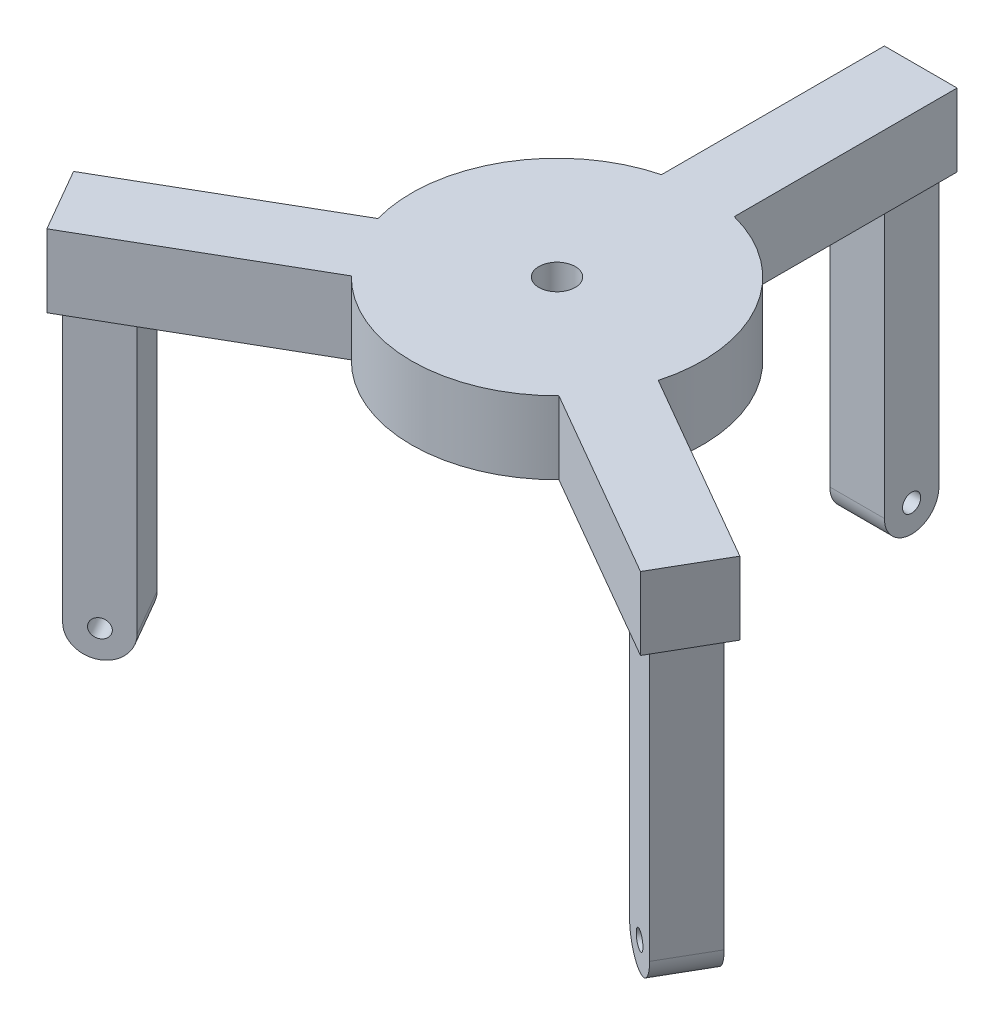
from build123d import *

# Parameters (mm, degrees)
BOSS_EXTRUDE1_DEPTH = 40
SKETCH2_W           = 30
SKETCH2_H           = 30
BOSS_EXTRUDE2_DEPTH = 150
BOSS_EXTRUDE4_DEPTH = 30
SKETCH5_R           = 5
CUT_EXTRUDE2_DEPTH  = 30
CIRPATTERN1_COUNT   = 3
SKETCH6_R           = 10
CUT_EXTRUDE3_DEPTH  = 50
SKETCH7_R           = 5
CUT_EXTRUDE4_DEPTH  = 30
SKETCH8_R           = 5
CUT_EXTRUDE5_DEPTH  = 30


with BuildPart() as part:
    # Sketch1 → Boss-Extrude1 (new body)
    with BuildSketch(Plane(origin=(0, 0, 0), x_dir=(1, 0, 0), z_dir=(0, 1, 0))):
        with BuildLine():
            ThreePointArc((-57.082039325, -56.050341538), (0, -80), (57.082039325, -56.050341538))
            ThreePointArc((57.082039325, -56.050341538), (69.282032303, -40), (77.082039325, -21.409325386))
            ThreePointArc((77.082039325, -21.409325386), (79.267153178, -10.80363027), (80, 0))
            ThreePointArc((80, 0), (63.245553203, 48.989794856), (20, 77.459666924))
            ThreePointArc((20, 77.459666924), (0, 80), (-20, 77.459666924))
            ThreePointArc((-20, 77.459666924), (-69.282032303, 40), (-77.082039325, -21.409325386))
            ThreePointArc((-77.082039325, -21.409325386), (-69.282032303, -40), (-57.082039325, -56.050341538))
        make_face()
        with BuildLine():
            ThreePointArc((-20, 77.459666924), (0, 80), (20, 77.459666924))
            Line((20, 77.459666924), (20, 200))
            Line((20, 200), (-20, 200))
            Line((-20, 200), (-20, 77.459666924))
        make_face()
        with BuildLine():
            Line((-163.205080757, -117.320508076), (-57.082039325, -56.050341538))
            ThreePointArc((-57.082039325, -56.050341538), (-69.282032303, -40), (-77.082039325, -21.409325386))
            Line((-77.082039325, -21.409325386), (-183.205080757, -82.679491924))
            Line((-183.205080757, -82.679491924), (-163.205080757, -117.320508076))
        make_face()
        with BuildLine():
            Line((57.082039325, -56.050341538), (163.205080757, -117.320508076))
            Line((163.205080757, -117.320508076), (183.205080757, -82.679491924))
            Line((183.205080757, -82.679491924), (77.082039325, -21.409325386))
            ThreePointArc((77.082039325, -21.409325386), (69.282032303, -40), (57.082039325, -56.050341538))
        make_face()
    extrude(amount=BOSS_EXTRUDE1_DEPTH)

    # Sketch2 → Boss-Extrude2 (add)
    with BuildSketch(Plane.XZ):
        with Locations((0, -180)):
            Rectangle(SKETCH2_W, SKETCH2_H)
    boss_extrude2 = extrude(amount=BOSS_EXTRUDE2_DEPTH)

    # Sketch3 → Boss-Extrude4 (add)
    with BuildSketch(Plane(origin=(15, 0, 0), x_dir=(0, 0, -1), z_dir=(1, 0, 0))):
        with BuildLine():
            Line((165, -150), (195, -150))
            ThreePointArc((195, -150), (180, -165), (165, -150))
        make_face()
    boss_extrude4 = extrude(amount=-BOSS_EXTRUDE4_DEPTH)

    # Sketch5 → Cut-Extrude2 (cut)
    with BuildSketch(Plane(origin=(15, 0, 0), x_dir=(0, 0, -1), z_dir=(1, 0, 0))):
        with Locations((180, -150)):
            Circle(SKETCH5_R)
    extrude(amount=-CUT_EXTRUDE2_DEPTH, mode=Mode.SUBTRACT)

    # CirPattern1: Boss-Extrude2, Boss-Extrude4 ×3 about axis
    cirpattern1_axis = Axis((0, 0, 0), (0, 1, 0))
    add([boss_extrude2.rotate(cirpattern1_axis, i * 360 / CIRPATTERN1_COUNT) for i in range(1, CIRPATTERN1_COUNT)])
    add([boss_extrude4.rotate(cirpattern1_axis, i * 360 / CIRPATTERN1_COUNT) for i in range(1, CIRPATTERN1_COUNT)])

    # Sketch6 → Cut-Extrude3 (cut)
    with BuildSketch(Plane(origin=(0, 40, 0), x_dir=(1, 0, 0), z_dir=(0, 1, 0))):
        with Locations(Location((0, 0, 0), (0, 0, 270))):
            Circle(SKETCH6_R)
    extrude(amount=-CUT_EXTRUDE3_DEPTH, mode=Mode.SUBTRACT)

    # Sketch7 → Cut-Extrude4 (cut)
    with BuildSketch(Plane(origin=(7.5, 0, 12.990381057), x_dir=(0.8660254037844434, 0, -0.49999999999999195), z_dir=(0.49999999999999195, 0, 0.8660254037844434))):
        with Locations((-180, -150)):
            Circle(SKETCH7_R)
    extrude(amount=-CUT_EXTRUDE4_DEPTH, mode=Mode.SUBTRACT)

    # Sketch8 → Cut-Extrude5 (cut)
    with BuildSketch(Plane(origin=(-7.5, 0, 12.990381057), x_dir=(0.8660254037844364, 0, 0.5000000000000041), z_dir=(-0.500000000000004, 0, 0.8660254037844363))):
        with Locations((180, -150)):
            Circle(SKETCH8_R)
    extrude(amount=-CUT_EXTRUDE5_DEPTH, mode=Mode.SUBTRACT)


solid = part.part
